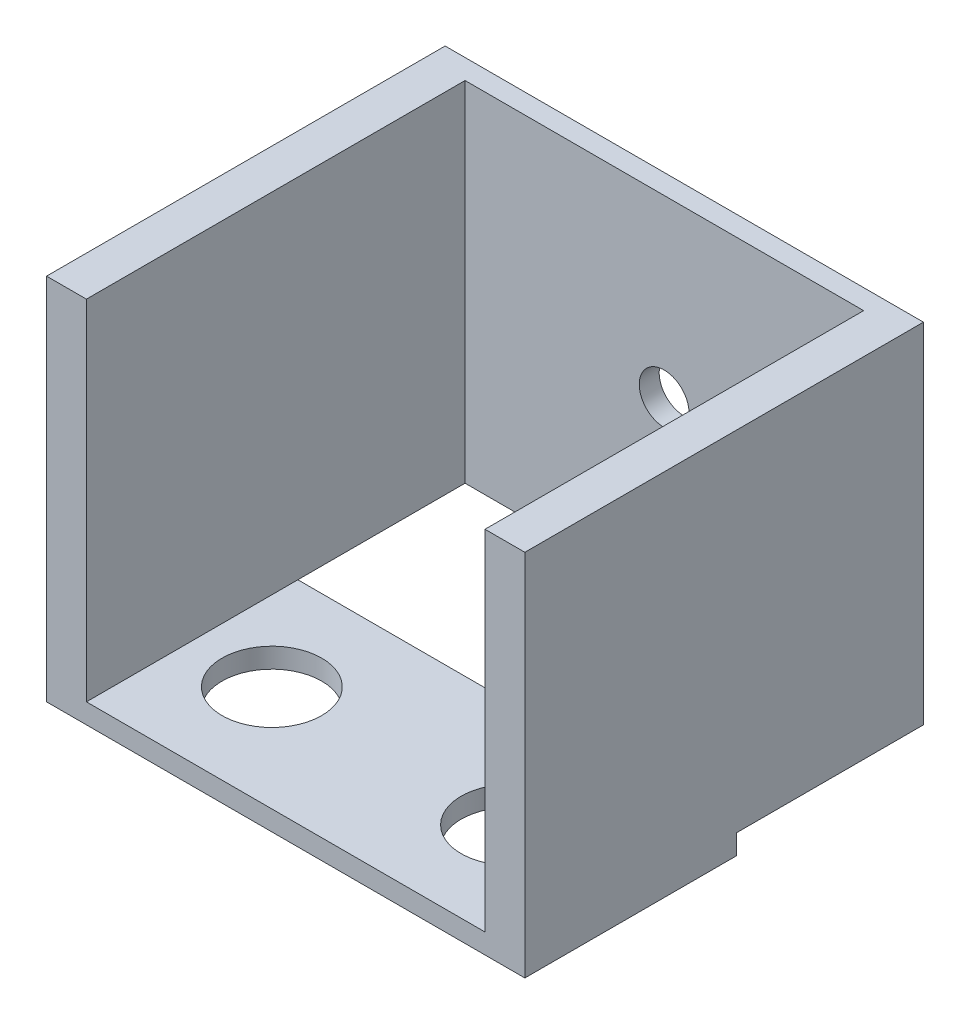
from build123d import *

# Parameters (mm, degrees)
ESBO_O1_W                = 48
ESBO_O1_H                = 35
ESBO_O1_R                = 2.5
RESSALTO_EXTRUS_O1_DEPTH = 2
ESBO_O2_W                = 4
ESBO_O2_H                = 35
RESSALTO_EXTRUS_O2_DEPTH = 38
ESBO_O3_W                = 48
ESBO_O3_H                = 21.220088249
ESBO_O3_R                = 5
RESSALTO_EXTRUS_O3_DEPTH = 2


with BuildPart() as part:
    # Esboço1 → Ressalto-extrusão1 (new body)
    with BuildSketch(Plane.XY):
        with Locations((-27.792174024, -21.17139219)):
            Rectangle(ESBO_O1_W, ESBO_O1_H)
        with Locations((-27.810949966, -21.337629256)):
            Circle(ESBO_O1_R, mode=Mode.SUBTRACT)
    extrude(amount=RESSALTO_EXTRUS_O1_DEPTH)

    # Esboço2 → Ressalto-extrusão2 (add)
    with BuildSketch(Plane.XY.offset(2)):
        with Locations((-49.792174024, -21.17139219)):
            Rectangle(ESBO_O2_W, ESBO_O2_H)
        with Locations((-5.792174024, -21.17139219)):
            Rectangle(ESBO_O2_W, ESBO_O2_H)
    extrude(amount=RESSALTO_EXTRUS_O2_DEPTH)

    # Esboço3 → Ressalto-extrusão3 (add)
    with BuildSketch(Plane.XZ.offset(38.67139219)):
        with Locations((-27.792174024, 29.389955876)):
            Rectangle(ESBO_O3_W, ESBO_O3_H)
        with Locations(Location((-39.792174024, 29.389955876, 0), (0, 0, 270))):
            Circle(ESBO_O3_R, mode=Mode.SUBTRACT)
        with Locations(Location((-15.792174024, 29.389955876, 0), (0, 0, 270))):
            Circle(ESBO_O3_R, mode=Mode.SUBTRACT)
    extrude(amount=RESSALTO_EXTRUS_O3_DEPTH)


solid = part.part
